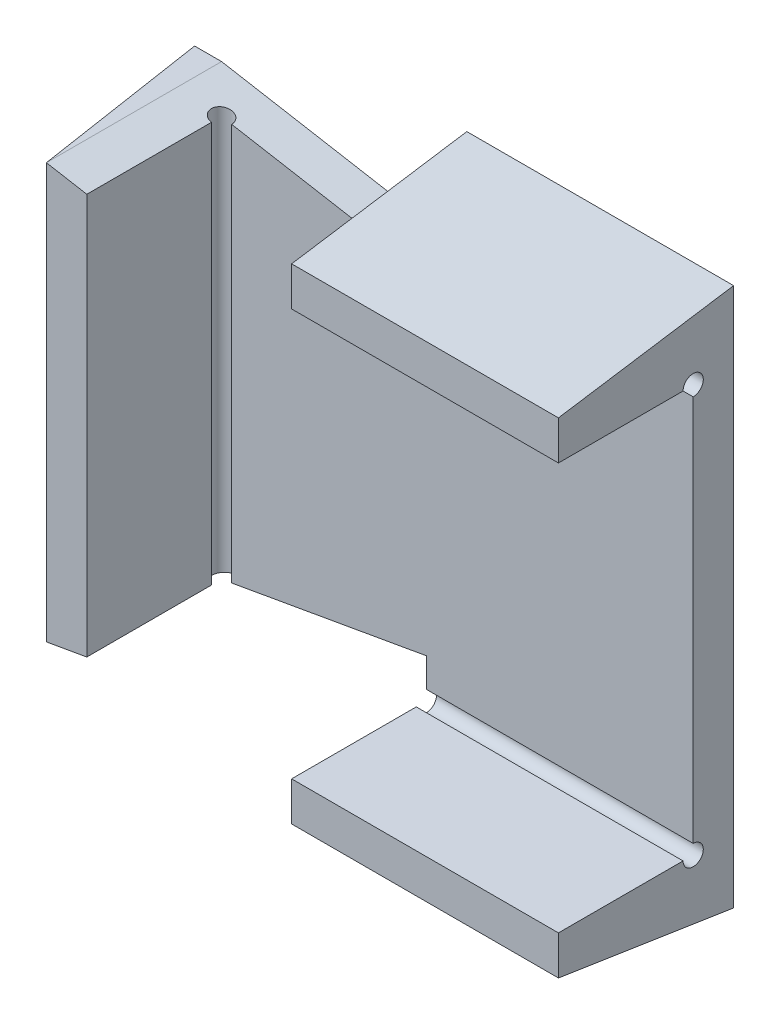
from build123d import *

# Parameters (mm, degrees)
ESQUISSE1_W                  = 38
ESQUISSE1_H                  = 36
BOSS_EXTRU_1_DEPTH           = 3
BOSS_EXTRU_2_DEPTH           = 10
ENL_V_MAT_EXTRU_1_DEPTH      = 54.935146241
ENL_V_MAT_EXTRU_1_DEPTH_BACK = 54.935146241
ESQUISSE4_R                  = 0.75
ENL_V_MAT_EXTRU_2_DEPTH      = 19.8
ENL_V_MAT_EXTRU_3_DEPTH      = 54.935146241
ENL_V_MAT_EXTRU_3_DEPTH_BACK = 54.935146241
ESQUISSE5_R                  = 0.75
BOSS_EXTRU_3_START           = -2.6
BOSS_EXTRU_3_DEPTH           = 30.8
BOSS_EXTRU_4_START           = -19.8
BOSS_EXTRU_4_DEPTH           = 19.8


with BuildPart() as part:
    # Esquisse1 → Boss.-Extru.1 (new body)
    with BuildSketch(Plane.XY):
        with Locations((19, 18)):
            Rectangle(ESQUISSE1_W, ESQUISSE1_H)
    extrude(amount=BOSS_EXTRU_1_DEPTH)

    # Esquisse2 → Boss.-Extru.2 (add)
    with BuildSketch(Plane.XY.offset(3)):
        Polygon((38, 33.1), (3, 33.1), (3, 2.9), (38, 2.9), (38, 0), (0, 0), (0, 36), (38, 36), align=None)
    extrude(amount=BOSS_EXTRU_2_DEPTH)

    # Esquisse3 → Enlèv. mat.-Extru.1 (cut, two sides: drawn at the far end of the back side and taken through both)
    with BuildSketch(Plane(origin=(0, 0, 0), x_dir=(-1, 0, 0), z_dir=(0, 0, -1)).offset(-ENL_V_MAT_EXTRU_1_DEPTH_BACK)):
        Polygon((0, 2.6), (0, 0), (-18.2, 0), (-18.2, 5.809151049), align=None)
        Polygon((-18.2, 36), (-18.2, 30.190848951), (0, 33.4), (0, 36), align=None)
    extrude(amount=ENL_V_MAT_EXTRU_1_DEPTH + ENL_V_MAT_EXTRU_1_DEPTH_BACK, mode=Mode.SUBTRACT)

    # Esquisse4 → Enlèv. mat.-Extru.2 (cut)
    with BuildSketch(Plane(origin=(38, 0, 0), x_dir=(0, 0, -1), z_dir=(1, 0, 0))):
        with Locations((-3, 2.9)):
            Circle(ESQUISSE4_R)
        with Locations((-3, 33.1)):
            Circle(ESQUISSE4_R)
    extrude(amount=-ENL_V_MAT_EXTRU_2_DEPTH, mode=Mode.SUBTRACT)

    # Esquisse5 → Enlèv. mat.-Extru.3 (cut, two sides: drawn at the far end of the back side and taken through both)
    with BuildSketch(Plane.XZ.offset(-ENL_V_MAT_EXTRU_3_DEPTH_BACK)):
        with Locations((3, 3)):
            Circle(ESQUISSE5_R)
    extrude(amount=ENL_V_MAT_EXTRU_3_DEPTH + ENL_V_MAT_EXTRU_3_DEPTH_BACK, mode=Mode.SUBTRACT)

    # Esquisse6 → Boss.-Extru.3 (add)
    with BuildSketch(Plane.XZ.offset(BOSS_EXTRU_3_START)):
        Polygon((0, 0), (0, 13), (-2, 0), align=None)
    extrude(amount=-BOSS_EXTRU_3_DEPTH)

    # Esquisse7 → Boss.-Extru.4 (add)
    with BuildSketch(Plane(origin=(38, 0, 0), x_dir=(0, 0, -1), z_dir=(1, 0, 0)).offset(BOSS_EXTRU_4_START)):
        Polygon((0, 0), (-13, 0), (0, -2), align=None)
        Polygon((0, 38), (0, 36), (-13, 36), align=None)
    extrude(amount=BOSS_EXTRU_4_DEPTH)


solid = part.part
